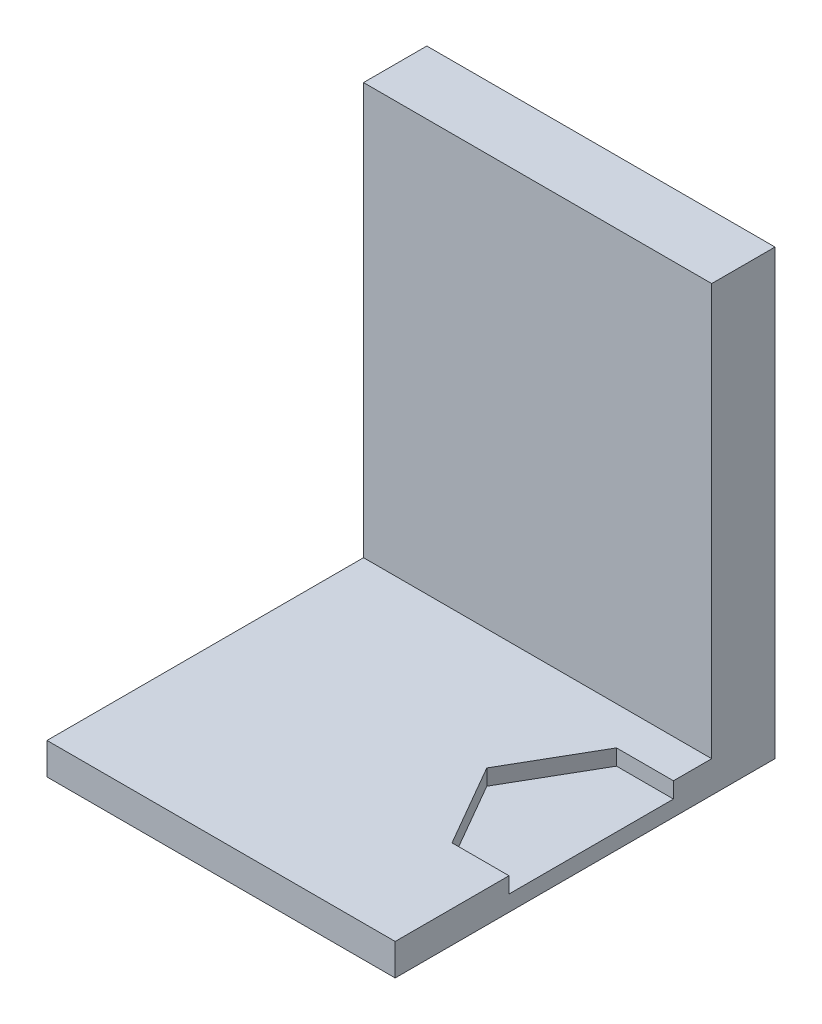
from build123d import *

# Parameters (mm, degrees)
SKETCH1_W                      = 670
SKETCH1_H                      = 120
BOSS_EXTRUDE1_DEPTH            = 530
SKETCH2_W                      = 100
SKETCH2_H                      = 200
SKETCH2_W_2                    = 650
SKETCH2_H_2                    = 250
CUT_EXTRUDE1_DEPTH             = 100
SKETCH3_R                      = 50
CUT_EXTRUDE2_DEPTH             = 260
F_12_0_12_DIAMETER_HOLE2_D     = 12
F_12_0_12_DIAMETER_HOLE2_DEPTH = 30
F_12_0_12_DIAMETER_HOLE2_TIP   = 3.605163714
SKETCH8_W                      = 650
SKETCH8_H                      = 50
BOSS_EXTRUDE2_DEPTH            = 5
SKETCH9_W                      = 10
SKETCH9_H                      = 250
CUT_EXTRUDE3_DEPTH             = 717
CUT_EXTRUDE4_DEPTH             = 5
SKETCH11_W                     = 10
SKETCH11_H                     = 100
BOSS_EXTRUDE3_DEPTH            = 78
BOSS_EXTRUDE3_2_DEPTH          = 78
BOSS_EXTRUDE3_3_DEPTH          = 78
SKETCH12_W                     = 20
SKETCH12_H                     = 30
CUT_EXTRUDE5_DEPTH             = 80
SKETCH15_W                     = 30
SKETCH15_H                     = 23.536156656
SKETCH15_H_2                   = 28.986603691
CUT_EXTRUDE7_DEPTH             = 35
SHELL1_T                       = -3
SKETCH16_W                     = 14
SKETCH16_H                     = 14
CUT_EXTRUDE8_DEPTH             = 35
SKETCH17_W                     = 5.729882812
SKETCH17_H                     = 17.428393554
SKETCH17_W_2                   = 13.369726562
SKETCH17_H_2                   = 3.342431641
BOSS_EXTRUDE4_DEPTH            = 5
CUT_EXTRUDE10_DEPTH            = 863.670273187
CUT_EXTRUDE10_DEPTH_BACK       = 863.670273187
SKETCH18_W                     = 670
SKETCH18_H                     = 250
CUT_EXTRUDE13_DEPTH            = 737.002717386
CUT_EXTRUDE13_DEPTH_BACK       = 737.002717386
SKETCH19_W                     = 228
SKETCH19_H                     = 280
SKETCH19_W_2                   = 332
CUT_EXTRUDE14_DEPTH            = 451.159971566
CUT_EXTRUDE14_DEPTH_BACK       = 451.159971566
SKETCH20_W                     = 110
SKETCH20_H                     = 140


with BuildPart() as part:
    # Sketch1 → Boss-Extrude1 (new body)
    with BuildSketch(Plane(origin=(0, 0, 0), x_dir=(1, 0, 0), z_dir=(0, 1, 0))):
        with Locations((335, 60)):
            Rectangle(SKETCH1_W, SKETCH1_H)
    extrude(amount=BOSS_EXTRUDE1_DEPTH)

    # Sketch2 → Cut-Extrude1 (cut)
    with BuildSketch(Plane.XY):
        with Locations((60, 380)):
            Rectangle(SKETCH2_W, SKETCH2_H)
        with Locations((170, 380)):
            Rectangle(SKETCH2_W, SKETCH2_H)
        with Locations((280, 380)):
            Rectangle(SKETCH2_W, SKETCH2_H)
        with Locations((390, 380)):
            Rectangle(SKETCH2_W, SKETCH2_H)
        with Locations((500, 380)):
            Rectangle(SKETCH2_W, SKETCH2_H)
        with Locations((610, 380)):
            Rectangle(SKETCH2_W, SKETCH2_H)
        with Locations((335, 135)):
            Rectangle(SKETCH2_W_2, SKETCH2_H_2)
    extrude(amount=-CUT_EXTRUDE1_DEPTH, mode=Mode.SUBTRACT)

    # Sketch3 → Cut-Extrude2 (cut)
    with BuildSketch(Plane(origin=(0, 530, 0), x_dir=(1, 0, 0), z_dir=(0, 1, 0))):
        with Locations((60, 60)):
            Circle(SKETCH3_R)
        with Locations((170, 60)):
            Circle(SKETCH3_R)
        with Locations((280, 60)):
            Circle(SKETCH3_R)
        with Locations((390, 60)):
            Circle(SKETCH3_R)
        with Locations((500, 60)):
            Circle(SKETCH3_R)
        with Locations((610, 60)):
            Circle(SKETCH3_R)
    extrude(amount=-CUT_EXTRUDE2_DEPTH, mode=Mode.SUBTRACT)

    # Ø12.0 (12) Diameter Hole2
    with Locations(Plane(origin=(59.704642413, 270, -102.411697903), x_dir=(0, 0, 1), z_dir=(0, 1, 0))):
        with Locations((0, 0), (-0.195888006, 111.8520513), (0.014838595, 221.167624818), (-0.341843303, 331.364008353), (0.657723149, 441.008646429), (1.288998006, 549.811854685)):
            Hole(F_12_0_12_DIAMETER_HOLE2_D / 2, depth=F_12_0_12_DIAMETER_HOLE2_DEPTH)
            with Locations((0, 0, -(F_12_0_12_DIAMETER_HOLE2_DEPTH + F_12_0_12_DIAMETER_HOLE2_TIP / 2))):  # 118° drill point
                Cone(0, F_12_0_12_DIAMETER_HOLE2_D / 2, F_12_0_12_DIAMETER_HOLE2_TIP, mode=Mode.SUBTRACT)

    # Sketch8 → Boss-Extrude2 (add)
    with BuildSketch(Plane.XY):
        with Locations((335, 305)):
            Rectangle(SKETCH8_W, SKETCH8_H)
    extrude(amount=-BOSS_EXTRUDE2_DEPTH)

    # Sketch9 → Cut-Extrude3 (cut)
    with BuildSketch(Plane(origin=(670, 0, 0), x_dir=(0, 0, -1), z_dir=(1, 0, 0))):
        with Locations((15, 135)):
            Rectangle(SKETCH9_W, SKETCH9_H)
    extrude(amount=-CUT_EXTRUDE3_DEPTH, mode=Mode.SUBTRACT)

    # Sketch10 → Cut-Extrude4 (cut)
    with BuildSketch(Plane(origin=(0, 10, 0), x_dir=(1, 0, 0), z_dir=(0, 1, 0))):
        Polygon((365, 61.943560596), (350, 87.924322709), (320, 87.924322709), (305, 61.943560596), (320, 35.962798482), (350, 35.962798482), align=None)
    extrude(amount=-CUT_EXTRUDE4_DEPTH, mode=Mode.SUBTRACT)

    # Sketch12 → Cut-Extrude5 (cut)
    with BuildSketch(Plane.XY.offset(-100)):
        with Locations((85.198613037, 245)):
            Rectangle(SKETCH12_W, SKETCH12_H)
        with Locations((195.198613037, 245)):
            Rectangle(SKETCH12_W, SKETCH12_H)
        with Locations((305.198613037, 245)):
            Rectangle(SKETCH12_W, SKETCH12_H)
        with Locations((415.198613037, 245)):
            Rectangle(SKETCH12_W, SKETCH12_H)
        with Locations((525.198613037, 245)):
            Rectangle(SKETCH12_W, SKETCH12_H)
        with Locations((635.198613037, 245)):
            Rectangle(SKETCH12_W, SKETCH12_H)
    extrude(amount=-CUT_EXTRUDE5_DEPTH, mode=Mode.SUBTRACT)

    # Sketch17 → Boss-Extrude4 (add)
    # profile 1 of 9: a face of its own
    with BuildSketch(Plane.XY):
        with BuildLine():
            Line((527.508830928, 289.835452458), (527.508830928, 307.263846012))
            Line((527.508830928, 307.263846012), (534.861434459, 307.263846012))
            add(Edge.make_bspline(
                [(534.861434459, 307.263846012), (535.181337774, 307.258256848), (535.803061116, 307.24739446), (536.703508491, 307.139069344), (537.544992916, 306.975202489), (538.325061607, 306.737496792), (539.040841948, 306.426020155), (539.698044515, 306.051894954), (540.290333057, 305.605079277), (540.822348212, 305.090232636), (541.284521701, 304.502523111), (541.692171296, 303.852565801), (542.030284458, 303.129762281), (542.309377095, 302.341316546), (542.5243908, 301.484161689), (542.679660381, 300.560045938), (542.773357357, 299.567500804), (542.783368073, 298.883107022), (542.788518428, 298.530997273)],
                knots=[0, 0, 0, 0, 1.135059408, 2.20595691, 3.214417064, 4.174978569, 5.094187092, 5.980001006, 6.853065862, 7.720814779, 8.600404634, 9.50058483, 10.438414914, 11.426825708, 12.465239141, 13.571113463, 14.750376389, 16, 16, 16, 16], degree=3))
            add(Edge.make_bspline(
                [(542.788518428, 298.530997273), (542.781740751, 298.180151665), (542.768592871, 297.499553336), (542.676885992, 296.511518461), (542.516733301, 295.591080531), (542.296748778, 294.736450427), (542.003051046, 293.953120444), (541.654236167, 293.233205539), (541.233025793, 292.585291498), (540.753136904, 292.000029304), (540.204772188, 291.484681411), (539.587651059, 291.044279297), (538.910779309, 290.668464036), (538.169670382, 290.361903209), (537.364073889, 290.124869172), (536.495133477, 289.954199984), (535.562644449, 289.853487388), (534.920131033, 289.841584621), (534.58911581, 289.835452458)],
                knots=[0, 0, 0, 0, 1.228418252, 2.382983832, 3.470276728, 4.496757894, 5.468023682, 6.394867725, 7.292157164, 8.167372942, 9.039072913, 9.918728341, 10.815246345, 11.744296628, 12.720973084, 13.750736166, 14.841206188, 16, 16, 16, 16], degree=3))
            Line((534.58911581, 289.835452458), (527.508830928, 289.835452458))
        make_face()
        with BuildLine():
            Line((533.238713741, 291.745413395), (534.048208904, 291.745413395))
            add(Edge.make_bspline(
                [(534.048208904, 291.745413395), (534.172894012, 291.749291978), (534.413033311, 291.756761998), (534.758676231, 291.825976613), (535.075745017, 291.938271137), (535.365749176, 292.094802589), (535.623404602, 292.300450923), (535.848862806, 292.551404902), (536.04776914, 292.844737637), (536.217685755, 293.190205032), (536.364284647, 293.596533622), (536.481764702, 294.076367921), (536.592118304, 294.630928744), (536.673672739, 295.265507643), (536.740044562, 295.978448886), (536.788346679, 296.768428292), (536.812018936, 297.636801208), (536.817188964, 298.241258393), (536.819890499, 298.55711002)],
                knots=[0, 0, 0, 0, 0.728710832, 1.403472396, 2.052289494, 2.690292559, 3.321919393, 3.970736491, 4.656696891, 5.388631723, 6.217040872, 7.17856157, 8.275589967, 9.523440737, 10.918935818, 12.463926104, 14.152268318, 16, 16, 16, 16], degree=3))
            add(Edge.make_bspline(
                [(536.819890499, 298.55711002), (536.8171426, 298.871715251), (536.811863063, 299.476166083), (536.7886758, 300.343334385), (536.739579947, 301.133216935), (536.674703848, 301.843934916), (536.589660404, 302.476324031), (536.488366458, 303.031681737), (536.362441588, 303.507627045), (536.222158727, 303.914921549), (536.050140993, 304.256514038), (535.858357073, 304.554097881), (535.62547107, 304.79746827), (535.36991257, 305.004888479), (535.079348843, 305.160875844), (534.761320266, 305.273944358), (534.414185903, 305.34216807), (534.172870641, 305.349893944), (534.048208904, 305.353885075)],
                knots=[0, 0, 0, 0, 1.842836665, 3.540640921, 5.080358154, 6.47765669, 7.719902824, 8.816971715, 9.781579111, 10.601733135, 11.334613876, 12.017393917, 12.666641099, 13.29908421, 13.937911793, 14.587567384, 15.270347425, 16, 16, 16, 16], degree=3))
            Line((534.048208904, 305.353885075), (533.238713741, 305.353885075))
            Line((533.238713741, 305.353885075), (533.238713741, 291.745413395))
        make_face(mode=Mode.SUBTRACT)
    # profile 2 of 9: a face of its own
    with BuildSketch(Plane.XY):
        with Locations((547.563420772, 298.549649235)):
            Rectangle(SKETCH17_W, SKETCH17_H)
    # profile 3 of 9: a face of its own
    with BuildSketch(Plane.XY):
        Polygon((564.514324092, 307.263846012), (564.514324092, 305.115139958), (558.545696163, 305.115139958), (558.545696163, 299.862747379), (563.559343624, 299.862747379), (563.559343624, 297.714041325), (558.545696163, 297.714041325), (558.545696163, 289.835452458), (552.81581335, 289.835452458), (552.81581335, 307.263846012), align=None)
    # profile 4 of 9: a face of its own
    with BuildSketch(Plane.XY):
        Polygon((577.645305538, 307.263846012), (577.645305538, 305.115139958), (571.676677608, 305.115139958), (571.676677608, 299.862747379), (576.690325069, 299.862747379), (576.690325069, 297.714041325), (571.676677608, 297.714041325), (571.676677608, 289.835452458), (565.946794795, 289.835452458), (565.946794795, 307.263846012), align=None)
    # profile 5 of 9: a face of its own
    with BuildSketch(Plane.XY):
        with Locations((584.330168819, 287.448001286)):
            Rectangle(SKETCH17_W_2, SKETCH17_H_2)
    # profile 6 of 9: a face of its own
    with BuildSketch(Plane.XY):
        with BuildLine():
            Line((605.578484249, 307.263846012), (605.578484249, 295.602639195))
            add(Edge.make_bspline(
                [(605.578484249, 295.602639195), (605.574209777, 295.35989389), (605.565919345, 294.889083964), (605.480877158, 294.20653885), (605.349958188, 293.569747554), (605.15926554, 292.978838165), (604.911867049, 292.436847071), (604.616163877, 291.936663973), (604.260702644, 291.487723021), (603.847299908, 291.08966617), (603.386881991, 290.731670113), (602.867295001, 290.425440037), (602.293741958, 290.168488385), (601.66690529, 289.960990771), (600.988052682, 289.797299786), (600.254912883, 289.679078851), (599.467035781, 289.60781007), (598.923618241, 289.60048219), (598.643684673, 289.59670734)],
                knots=[0, 0, 0, 0, 1.108173197, 2.149326602, 3.136215123, 4.073726706, 4.978516626, 5.852185058, 6.72141202, 7.584905625, 8.467554395, 9.379216169, 10.332422268, 11.332766067, 12.390653242, 13.518530507, 14.721707419, 16, 16, 16, 16], degree=3))
            add(Edge.make_bspline(
                [(598.643684673, 289.59670734), (598.373688491, 289.600411437), (597.851346557, 289.607577482), (597.093280473, 289.679448684), (596.387523889, 289.797736542), (595.733050135, 289.960122315), (595.130189942, 290.169220301), (594.579048171, 290.42623041), (594.078350789, 290.732835498), (593.633858028, 291.090104794), (593.234289459, 291.486851767), (592.899913678, 291.940746827), (592.609043638, 292.435866034), (592.375223767, 292.980322997), (592.191754821, 293.570441519), (592.063541006, 294.20666921), (591.983676196, 294.889343196), (591.974661767, 295.359932437), (591.970012569, 295.602639195)],
                knots=[0, 0, 0, 0, 1.258901956, 2.435505865, 3.547148904, 4.59359074, 5.576649289, 6.5183682, 7.424469602, 8.307507093, 9.172751023, 10.042627298, 10.928839176, 11.845659241, 12.799442865, 13.80597989, 14.868432463, 16, 16, 16, 16], degree=3))
            Line((591.970012569, 295.602639195), (591.970012569, 307.263846012))
            Line((591.970012569, 307.263846012), (597.699895381, 307.263846012))
            Line((597.699895381, 307.263846012), (597.699895381, 295.457153889))
            add(Edge.make_bspline(
                [(597.699895381, 295.457153889), (597.700816195, 295.287996189), (597.702584578, 294.963135903), (597.729908723, 294.499051493), (597.768241004, 294.079064133), (597.828226169, 293.705517832), (597.90066041, 293.377063412), (597.989882091, 293.09281535), (598.094998068, 292.852496478), (598.225239063, 292.654232043), (598.380826623, 292.495135011), (598.55368342, 292.353231761), (598.757556996, 292.238543846), (598.987648905, 292.146224908), (599.243380948, 292.070549638), (599.526120553, 292.020376099), (599.83553351, 291.990763905), (600.049971942, 291.986424568), (600.161954402, 291.984158512)],
                knots=[0, 0, 0, 0, 1.622370975, 3.115695595, 4.458049099, 5.666011203, 6.742434742, 7.681714947, 8.519814998, 9.250928664, 9.942747364, 10.646898194, 11.389596108, 12.175933929, 13.021386247, 13.943159715, 14.925891993, 16, 16, 16, 16], degree=3))
            add(Edge.make_bspline(
                [(600.161954402, 291.984158512), (600.283927219, 291.987190593), (600.521124756, 291.993087005), (600.86597014, 292.03390861), (601.187714881, 292.103380086), (601.484890424, 292.205377303), (601.758665297, 292.332852529), (602.012761516, 292.484567923), (602.236391413, 292.674631152), (602.439076761, 292.888441291), (602.620738276, 293.128529789), (602.771757722, 293.399928575), (602.905501548, 293.697121508), (603.005823683, 294.025060118), (603.089837826, 294.379999499), (603.146989706, 294.763086929), (603.186210275, 295.174074524), (603.189394751, 295.457053988), (603.191033077, 295.602639195)],
                knots=[0, 0, 0, 0, 1.083870311, 2.107775948, 3.08105344, 4.003637981, 4.893545291, 5.761570557, 6.624657808, 7.49233129, 8.376387281, 9.291996285, 10.246843261, 11.267344133, 12.334180325, 13.486053461, 14.706643157, 16, 16, 16, 16], degree=3))
            Line((603.191033077, 295.602639195), (603.191033077, 307.263846012))
            Line((603.191033077, 307.263846012), (605.578484249, 307.263846012))
        make_face()
    # profile 7 of 9: a face of its own
    with BuildSketch(Plane.XY):
        with BuildLine():
            Line((619.731593227, 302.015183827), (616.739818477, 301.526502415))
            add(Edge.make_bspline(
                [(616.739818477, 301.526502415), (616.748849224, 301.670726223), (616.765660669, 301.939210177), (616.78429066, 302.312269209), (616.796668381, 302.625642376), (616.798628236, 302.814722915), (616.799504756, 302.899286839)],
                knots=[0, 0, 0, 0, 1.261802504, 2.348944521, 3.261585937, 4, 4, 4, 4], degree=3))
            add(Edge.make_bspline(
                [(616.799504756, 302.899286839), (616.798306068, 303.007660677), (616.795968139, 303.219033721), (616.750451916, 303.523894877), (616.694806916, 303.811547356), (616.604352699, 304.076787391), (616.488181329, 304.320314265), (616.348943917, 304.543955606), (616.184187178, 304.745078709), (615.995833421, 304.928129987), (615.778009957, 305.083200131), (615.536269472, 305.218702836), (615.269765326, 305.333844758), (614.978065514, 305.431346685), (614.660683072, 305.504624438), (614.319025281, 305.556776695), (613.952471696, 305.585673441), (613.699597795, 305.590260771), (613.568984889, 305.592630192)],
                knots=[0, 0, 0, 0, 1.079280541, 2.105035848, 3.067950317, 3.99715044, 4.889989748, 5.753421302, 6.617030865, 7.476358039, 8.364190572, 9.274590025, 10.235106994, 11.254473582, 12.337095886, 13.478601727, 14.697662529, 16, 16, 16, 16], degree=3))
            add(Edge.make_bspline(
                [(613.568984889, 305.592630192), (613.391954632, 305.58912286), (613.059112606, 305.582528579), (612.595688488, 305.495339748), (612.198743126, 305.361419257), (611.87165349, 305.163811893), (611.613188167, 304.909795747), (611.433841092, 304.593316589), (611.323009072, 304.224665915), (611.313400221, 303.959558324), (611.308367061, 303.820693775)],
                knots=[0, 0, 0, 0, 1.294917039, 2.43462794, 3.440028966, 4.347597256, 5.210608309, 6.06356377, 6.985685997, 8, 8, 8, 8], degree=3))
            add(Edge.make_bspline(
                [(611.308367061, 303.820693775), (611.317562032, 303.705133219), (611.336106628, 303.472068433), (611.47315858, 303.132808312), (611.695999602, 302.811560885), (612.009295906, 302.510664216), (612.404107796, 302.221967273), (612.884407504, 301.948533431), (613.450813789, 301.688189695), (613.862519081, 301.536023727), (614.080048656, 301.455624958)],
                knots=[0, 0, 0, 0, 0.716839541, 1.445735977, 2.240793036, 3.131329288, 4.131129903, 5.273471266, 6.559404876, 8, 8, 8, 8], degree=3))
            add(Edge.make_bspline(
                [(614.080048656, 301.455624958), (614.335934702, 301.364918412), (614.834564244, 301.188164095), (615.547657928, 300.88707802), (616.213068388, 300.5749594), (616.829579094, 300.246613346), (617.397833174, 299.90520698), (617.914851624, 299.544556457), (618.386199073, 299.173962102), (618.807001026, 298.783874588), (619.177995113, 298.378100064), (619.4958685, 297.952745357), (619.771807525, 297.51723103), (619.991113975, 297.061458502), (620.169645242, 296.594624218), (620.292698657, 296.11024444), (620.364288243, 295.609761088), (620.37516617, 295.270864226), (620.380681514, 295.099036213)],
                knots=[0, 0, 0, 0, 1.359488612, 2.649152603, 3.874964776, 5.039588756, 6.146130126, 7.193090393, 8.194917302, 9.146793662, 10.063845301, 10.944476293, 11.803344532, 12.641736646, 13.473440096, 14.302714936, 15.139439897, 16, 16, 16, 16], degree=3))
            add(Edge.make_bspline(
                [(620.380681514, 295.099036213), (620.374476075, 294.902306495), (620.362285176, 294.515820995), (620.280160209, 293.948630617), (620.138011896, 293.409496554), (619.938489338, 292.895972278), (619.681049879, 292.411946655), (619.366518754, 291.954381076), (618.996510229, 291.525099427), (618.5710008, 291.128381035), (618.102222518, 290.765302239), (617.587803957, 290.450854345), (617.034458515, 290.187092261), (616.444107988, 289.968993032), (615.81453624, 289.801373099), (615.145337453, 289.685291013), (614.438790193, 289.606619894), (613.954683001, 289.600062276), (613.70700941, 289.59670734)],
                knots=[0, 0, 0, 0, 0.972121714, 1.909782367, 2.824924061, 3.721832975, 4.62620438, 5.527836938, 6.46026819, 7.421000932, 8.398101015, 9.385579713, 10.394244048, 11.422703992, 12.491421888, 13.608778581, 14.776629625, 16, 16, 16, 16], degree=3))
            add(Edge.make_bspline(
                [(613.70700941, 289.59670734), (613.445745367, 289.599650312), (612.939893069, 289.605348413), (612.207608113, 289.66709241), (611.525297432, 289.760984454), (610.893395078, 289.899706116), (610.309273131, 290.072394336), (609.776099392, 290.288320955), (609.295310255, 290.547303481), (608.863217672, 290.843007892), (608.478306623, 291.175775461), (608.148120946, 291.551766865), (607.86942369, 291.967163224), (607.639947144, 292.421521488), (607.466477665, 292.917583541), (607.339164663, 293.449829748), (607.264537999, 294.021332449), (607.254747521, 294.414908557), (607.249700069, 294.617815586)],
                knots=[0, 0, 0, 0, 1.342201143, 2.598733168, 3.773451092, 4.878874364, 5.91991243, 6.900006476, 7.829142054, 8.72062616, 9.585588575, 10.436728592, 11.283829734, 12.149664931, 13.044964919, 13.977937424, 14.957531465, 16, 16, 16, 16], degree=3))
            add(Edge.make_bspline(
                [(607.249700069, 294.617815586), (607.250803815, 294.692425759), (607.253213998, 294.855347393), (607.260452266, 295.122772538), (607.275636683, 295.433682216), (607.29037174, 295.656130545), (607.298195171, 295.774237248)],
                knots=[0, 0, 0, 0, 0.773500207, 1.689044709, 2.77302154, 4, 4, 4, 4], degree=3))
            Line((607.298195171, 295.774237248), (610.36457777, 296.337526509))
            add(Edge.make_bspline(
                [(610.36457777, 296.337526509), (610.326952988, 296.136337493), (610.255606535, 295.754830366), (610.178678473, 295.21219969), (610.124206629, 294.733311493), (610.11767002, 294.435147371), (610.114641475, 294.297001835)],
                knots=[0, 0, 0, 0, 1.192988372, 2.262218769, 3.194850416, 4, 4, 4, 4], degree=3))
            add(Edge.make_bspline(
                [(610.114641475, 294.297001835), (610.116191817, 294.183708768), (610.119182568, 293.965156219), (610.159053378, 293.648552813), (610.215988606, 293.352999663), (610.302906772, 293.079707227), (610.411206928, 292.826307836), (610.544682453, 292.59538211), (610.704385489, 292.386485019), (610.887496571, 292.200099922), (611.094689168, 292.033628705), (611.327456494, 291.892756696), (611.58347653, 291.771733922), (611.864681562, 291.677479524), (612.167961721, 291.596080628), (612.497219749, 291.548235723), (612.849461228, 291.512043782), (613.092629543, 291.508500084), (613.218327999, 291.506668278)],
                knots=[0, 0, 0, 0, 1.135776692, 2.191015738, 3.19649269, 4.151244236, 5.061952528, 5.956281389, 6.819534407, 7.692823504, 8.571441916, 9.478554956, 10.416037156, 11.406231466, 12.450054172, 13.561596327, 14.739541482, 16, 16, 16, 16], degree=3))
            add(Edge.make_bspline(
                [(613.218327999, 291.506668278), (613.423996012, 291.510791273), (613.810619321, 291.518541853), (614.349272542, 291.616708407), (614.810575885, 291.768742445), (615.189785268, 291.991387532), (615.490778961, 292.278756613), (615.698005174, 292.637320004), (615.824813318, 293.05638326), (615.837728413, 293.355975238), (615.844524288, 293.513619419)],
                knots=[0, 0, 0, 0, 1.308765556, 2.460272085, 3.475015317, 4.388076298, 5.239673503, 6.095681635, 6.997954785, 8, 8, 8, 8], degree=3))
            add(Edge.make_bspline(
                [(615.844524288, 293.513619419), (615.833808824, 293.638242951), (615.811807312, 293.894126055), (615.644884004, 294.264515838), (615.382382362, 294.620631473), (615.016807277, 294.962984909), (614.551376589, 295.293471235), (613.986957743, 295.616730224), (613.322148235, 295.933112033), (612.83677959, 296.119639164), (612.580430889, 296.21815395)],
                knots=[0, 0, 0, 0, 0.667930748, 1.371427933, 2.146459016, 3.034714139, 4.04893387, 5.207327294, 6.525042705, 8, 8, 8, 8], degree=3))
            add(Edge.make_bspline(
                [(612.580430889, 296.21815395), (612.374354345, 296.29679374), (611.970646869, 296.450850434), (611.394079385, 296.713586304), (610.853066711, 296.987016804), (610.357486361, 297.288235735), (609.896382561, 297.599610528), (609.477036946, 297.932256792), (609.09841673, 298.284556341), (608.758710772, 298.653375077), (608.457302107, 299.038989264), (608.199448649, 299.444659231), (607.977533299, 299.866789834), (607.798609588, 300.308107488), (607.65975715, 300.767821241), (607.559616231, 301.244439392), (607.497905054, 301.739995674), (607.491630423, 302.075933546), (607.488445186, 302.246468159)],
                knots=[0, 0, 0, 0, 1.249558333, 2.447906163, 3.58867143, 4.682264114, 5.731748367, 6.739728761, 7.711906036, 8.659384707, 9.578321416, 10.481344598, 11.379544271, 12.277135726, 13.175418307, 14.097160112, 15.034047388, 16, 16, 16, 16], degree=3))
            add(Edge.make_bspline(
                [(607.488445186, 302.246468159), (607.49282555, 302.439538736), (607.501402184, 302.817565692), (607.587451154, 303.36980586), (607.719291893, 303.894921371), (607.910558542, 304.389343064), (608.156192894, 304.852853762), (608.453187669, 305.288766511), (608.804241719, 305.697593471), (609.213503754, 306.066686531), (609.657214714, 306.407618241), (610.14376173, 306.697651931), (610.658716537, 306.950861947), (611.210636666, 307.148827868), (611.791820619, 307.313252612), (612.408080529, 307.421140415), (613.056315391, 307.490701612), (613.499160755, 307.498567824), (613.725661373, 307.502591129)],
                knots=[0, 0, 0, 0, 1.01033566, 1.978209831, 2.919499157, 3.840961976, 4.746855014, 5.660740114, 6.597989116, 7.56120833, 8.541877795, 9.523498025, 10.522416858, 11.542172371, 12.589598349, 13.681636521, 14.814234488, 16, 16, 16, 16], degree=3))
            add(Edge.make_bspline(
                [(613.725661373, 307.502591129), (613.968269855, 307.498219033), (614.438190994, 307.489750488), (615.120391152, 307.426787419), (615.755073228, 307.319142339), (616.345153155, 307.171557286), (616.887304575, 306.977590666), (617.384933999, 306.742393454), (617.834452216, 306.46201507), (618.236961315, 306.139451502), (618.593086714, 305.773322851), (618.897467704, 305.361641069), (619.158701245, 304.909408454), (619.366684143, 304.412232174), (619.529870326, 303.873247147), (619.649133834, 303.29158184), (619.720420497, 302.667301443), (619.72779778, 302.236712324), (619.731593227, 302.015183827)],
                knots=[0, 0, 0, 0, 1.248314423, 2.417925914, 3.521398822, 4.558068205, 5.543720209, 6.479599284, 7.385061127, 8.263440163, 9.127722873, 10.00561236, 10.891325273, 11.808802823, 12.772251995, 13.784947978, 14.860405143, 16, 16, 16, 16], degree=3))
        make_face()
    # profile 8 of 9: a face of its own
    with BuildSketch(Plane.XY):
        Polygon((633.989153194, 307.263846012), (633.989153194, 305.115139958), (628.020525264, 305.115139958), (628.020525264, 300.340237614), (633.034172725, 300.340237614), (633.034172725, 298.191531559), (628.020525264, 298.191531559), (628.020525264, 291.984158512), (634.944133663, 291.984158512), (634.944133663, 289.835452458), (622.290642452, 289.835452458), (622.290642452, 307.263846012), align=None)
    # profile 9 of 9: a face of its own
    with BuildSketch(Plane.XY):
        with BuildLine():
            Line((636.376604366, 289.835452458), (636.376604366, 307.263846012))
            Line((636.376604366, 307.263846012), (643.990335369, 307.263846012))
            add(Edge.make_bspline(
                [(643.990335369, 307.263846012), (644.237946498, 307.261150834), (644.721600887, 307.25588639), (645.426490561, 307.189203683), (646.094808274, 307.090496236), (646.724915796, 306.949857504), (647.317873659, 306.767252686), (647.871119087, 306.542146), (648.390701058, 306.282329135), (648.864494846, 305.976472528), (649.295093616, 305.642889252), (649.669668547, 305.279483604), (649.990389523, 304.894749072), (650.250664962, 304.483256345), (650.454275633, 304.048690948), (650.59581384, 303.587791605), (650.684089268, 303.104102537), (650.695510601, 302.772834174), (650.701311397, 302.604585835)],
                knots=[0, 0, 0, 0, 1.303269877, 2.545653735, 3.724355284, 4.8584284, 5.941462088, 6.987020715, 8.000098032, 8.995332524, 9.951400474, 10.863507538, 11.737823931, 12.582415999, 13.420128714, 14.25671499, 15.114600608, 16, 16, 16, 16], degree=3))
            add(Edge.make_bspline(
                [(650.701311397, 302.604585835), (650.698282873, 302.472674957), (650.692382063, 302.215658276), (650.651041486, 301.838684287), (650.580643818, 301.480313933), (650.481036683, 301.139915259), (650.347814833, 300.820175594), (650.191279492, 300.517863507), (650.009772227, 300.230553342), (649.788675198, 299.970497982), (649.548268341, 299.722842359), (649.274558803, 299.497116911), (648.974487035, 299.288655528), (648.642526299, 299.104010513), (648.287619671, 298.928055749), (647.899038177, 298.784921972), (647.486819978, 298.644749395), (647.19793098, 298.577036306), (647.049257183, 298.54218845)],
                knots=[0, 0, 0, 0, 1.057156483, 2.059775939, 3.035078039, 3.981068617, 4.897189472, 5.80650904, 6.70770952, 7.613691521, 8.536886357, 9.470937334, 10.45233069, 11.461024139, 12.51295332, 13.623444893, 14.776929983, 16, 16, 16, 16], degree=3))
            add(Edge.make_bspline(
                [(647.049257183, 298.54218845), (647.19164695, 298.499279419), (647.467865022, 298.416041346), (647.856360945, 298.265600017), (648.211652989, 298.111536308), (648.524185739, 297.936781388), (648.807636894, 297.762122504), (649.047122259, 297.564301324), (649.255235567, 297.361673563), (649.425188343, 297.135464734), (649.570253643, 296.882344437), (649.694827156, 296.586596707), (649.815179167, 296.247423665), (649.917667348, 295.859098311), (650.004750555, 295.423699276), (650.088222437, 294.944027189), (650.153853601, 294.416024546), (650.187587341, 294.048412906), (650.2051692, 293.856815525)],
                knots=[0, 0, 0, 0, 1.149282524, 2.229462177, 3.219229774, 4.139917433, 4.995948464, 5.788695735, 6.536448429, 7.236319808, 7.968460079, 8.78645307, 9.713791991, 10.749194692, 11.887975363, 13.146018663, 14.512518948, 16, 16, 16, 16], degree=3))
            add(Edge.make_bspline(
                [(650.2051692, 293.856815525), (650.225980287, 293.627849833), (650.265975604, 293.187817268), (650.348933081, 292.554613589), (650.44386163, 291.974357025), (650.555874504, 291.44528724), (650.681301216, 290.967898855), (650.821280597, 290.540469593), (650.979920039, 290.165788217), (651.10484481, 289.941461656), (651.163880062, 289.835452458)],
                knots=[0, 0, 0, 0, 1.324580516, 2.545615266, 3.678710841, 4.711533017, 5.660403917, 6.521349952, 7.301239649, 8, 8, 8, 8], degree=3))
            Line((651.163880062, 289.835452458), (645.213904094, 289.835452458))
            add(Edge.make_bspline(
                [(645.213904094, 289.835452458), (645.12229736, 290.069847279), (644.935171241, 290.548648246), (644.7595281, 291.319414791), (644.64846922, 292.142514735), (644.635117598, 292.70994511), (644.628232479, 293.002555653)],
                knots=[0, 0, 0, 0, 0.930410518, 1.900560147, 2.917368081, 4, 4, 4, 4], degree=3))
            Line((644.628232479, 293.002555653), (644.605850124, 294.002300831))
            Line((644.605850124, 294.002300831), (644.579737377, 295.266903874))
            add(Edge.make_bspline(
                [(644.579737377, 295.266903874), (644.573694669, 295.477395004), (644.562357007, 295.872330118), (644.469348432, 296.426164013), (644.30178735, 296.894645884), (644.073222546, 297.287223005), (643.766741442, 297.590613479), (643.39104803, 297.804152917), (642.950456912, 297.93396284), (642.634664848, 297.946292392), (642.468335247, 297.952786442)],
                knots=[0, 0, 0, 0, 1.295300309, 2.430314163, 3.439929415, 4.342995669, 5.203512789, 6.060756153, 6.978588463, 8, 8, 8, 8], degree=3))
            Line((642.468335247, 297.952786442), (642.106487178, 297.952786442))
            Line((642.106487178, 297.952786442), (642.106487178, 289.835452458))
            Line((642.106487178, 289.835452458), (636.376604366, 289.835452458))
        make_face()
        with BuildLine():
            Line((642.106487178, 299.862747379), (642.617550945, 299.862747379))
            add(Edge.make_bspline(
                [(642.617550945, 299.862747379), (642.722054451, 299.865172716), (642.925280724, 299.869889229), (643.220054897, 299.898289891), (643.494111408, 299.951809873), (643.749840966, 300.021017819), (643.984372137, 300.114851792), (644.200147241, 300.225818296), (644.391160406, 300.362685327), (644.565327067, 300.516342321), (644.718148635, 300.691986294), (644.850351299, 300.889034217), (644.961199162, 301.106225057), (645.056078491, 301.342818683), (645.125883912, 301.600830857), (645.173262731, 301.879472914), (645.203404658, 302.177423605), (645.207875435, 302.383174491), (645.210173702, 302.488943669)],
                knots=[0, 0, 0, 0, 1.184986479, 2.304423995, 3.352332712, 4.347714965, 5.303263624, 6.211353909, 7.091434645, 7.960150225, 8.839440182, 9.723126897, 10.64371617, 11.599264829, 12.608232147, 13.667459739, 14.800924404, 16, 16, 16, 16], degree=3))
            add(Edge.make_bspline(
                [(645.210173702, 302.488943669), (645.207875435, 302.594712847), (645.203404658, 302.800463732), (645.173262731, 303.098414423), (645.125883912, 303.37705648), (645.056078491, 303.635068654), (644.961199162, 303.87166228), (644.850351299, 304.08885312), (644.718148635, 304.285901043), (644.565327067, 304.461545017), (644.391160406, 304.61520201), (644.200147241, 304.752069041), (643.984372137, 304.863035546), (643.749840966, 304.956869518), (643.494111408, 305.026077464), (643.220054897, 305.079597446), (642.925280724, 305.107998108), (642.722054451, 305.112714621), (642.617550945, 305.115139958)],
                knots=[0, 0, 0, 0, 1.199075596, 2.332540261, 3.391767853, 4.400735171, 5.35628383, 6.276873103, 7.160559818, 8.039849775, 8.908565355, 9.788646091, 10.696736376, 11.652285035, 12.647667288, 13.695576005, 14.815013521, 16, 16, 16, 16], degree=3))
            Line((642.617550945, 305.115139958), (642.106487178, 305.115139958))
            Line((642.106487178, 305.115139958), (642.106487178, 299.862747379))
        make_face(mode=Mode.SUBTRACT)
    extrude(amount=BOSS_EXTRUDE4_DEPTH)

    # Sketch18 → Cut-Extrude10 (cut, two sides: drawn at the far end of the back side and taken through both)
    with BuildSketch(Plane.XY.offset(-CUT_EXTRUDE10_DEPTH_BACK)):
        with Locations((335, 405)):
            Rectangle(SKETCH18_W, SKETCH18_H)
    extrude(amount=CUT_EXTRUDE10_DEPTH + CUT_EXTRUDE10_DEPTH_BACK, mode=Mode.SUBTRACT)

    # Sketch19 → Cut-Extrude13 (cut, two sides: drawn at the far end of the back side and taken through both)
    with BuildSketch(Plane(origin=(0, 0, -120), x_dir=(-1, 0, 0), z_dir=(0, 0, -1)).offset(-CUT_EXTRUDE13_DEPTH_BACK)):
        with Locations((-114, 140)):
            Rectangle(SKETCH19_W, SKETCH19_H)
        with Locations((-504, 140)):
            Rectangle(SKETCH19_W_2, SKETCH19_H)
    extrude(amount=CUT_EXTRUDE13_DEPTH + CUT_EXTRUDE13_DEPTH_BACK, mode=Mode.SUBTRACT)

    # Sketch20 → Cut-Extrude14 (cut, two sides: drawn at the far end of the back side and taken through both)
    with BuildSketch(Plane.XY.offset(-100).offset(-CUT_EXTRUDE14_DEPTH_BACK)):
        with Locations((283, 210)):
            Rectangle(SKETCH20_W, SKETCH20_H)
    extrude(amount=CUT_EXTRUDE14_DEPTH + CUT_EXTRUDE14_DEPTH_BACK, mode=Mode.SUBTRACT)


with BuildPart() as body_2:
    # Sketch11 → Boss-Extrude3 (new body)
    with BuildSketch(Plane.XY.offset(-100)):
        with Locations((255, 60)):
            Rectangle(SKETCH11_W, SKETCH11_H)
    extrude(amount=BOSS_EXTRUDE3_DEPTH)


with BuildPart() as body_3:
    # Sketch11 → Boss-Extrude3 2 (new body)
    with BuildSketch(Plane.XY.offset(-100)):
        with Locations((415, 60)):
            Rectangle(SKETCH11_W, SKETCH11_H)
    extrude(amount=BOSS_EXTRUDE3_2_DEPTH)


with BuildPart() as body_4:
    # Sketch11 → Boss-Extrude3 3 (new body)
    with BuildSketch(Plane.XY.offset(-100)):
        Polygon((25, 198.45686471), (325, 145.558770497), (325, 122.01775856), (345, 122.01775856), (345, 145.558770497), (645, 198.45686471), align=None)
    extrude(amount=BOSS_EXTRUDE3_3_DEPTH)

    # Sketch15 → Cut-Extrude7 (cut)
    with BuildSketch(Plane(origin=(345, 0, 0), x_dir=(0, 0, -1), z_dir=(1, 0, 0))):
        with Locations((35, 133.231921672)):
            Rectangle(SKETCH15_W, SKETCH15_H)
        with Locations((85, 130.506698154)):
            Rectangle(SKETCH15_W, SKETCH15_H_2)
    extrude(amount=-CUT_EXTRUDE7_DEPTH, mode=Mode.SUBTRACT)

    # Shell1
    shell1_openings = [body_4.faces().sort_by_distance(p)[0] for p in [
        (335, 198.45686471, -61),
    ]]
    offset(amount=SHELL1_T, openings=shell1_openings, kind=Kind.INTERSECTION)

    # Sketch16 → Cut-Extrude8 (cut)
    with BuildSketch(Plane.XZ.offset(-122.01775856)):
        with Locations((335, -60)):
            Rectangle(SKETCH16_W, SKETCH16_H)
    extrude(amount=-CUT_EXTRUDE8_DEPTH, mode=Mode.SUBTRACT)


solid = part.part
